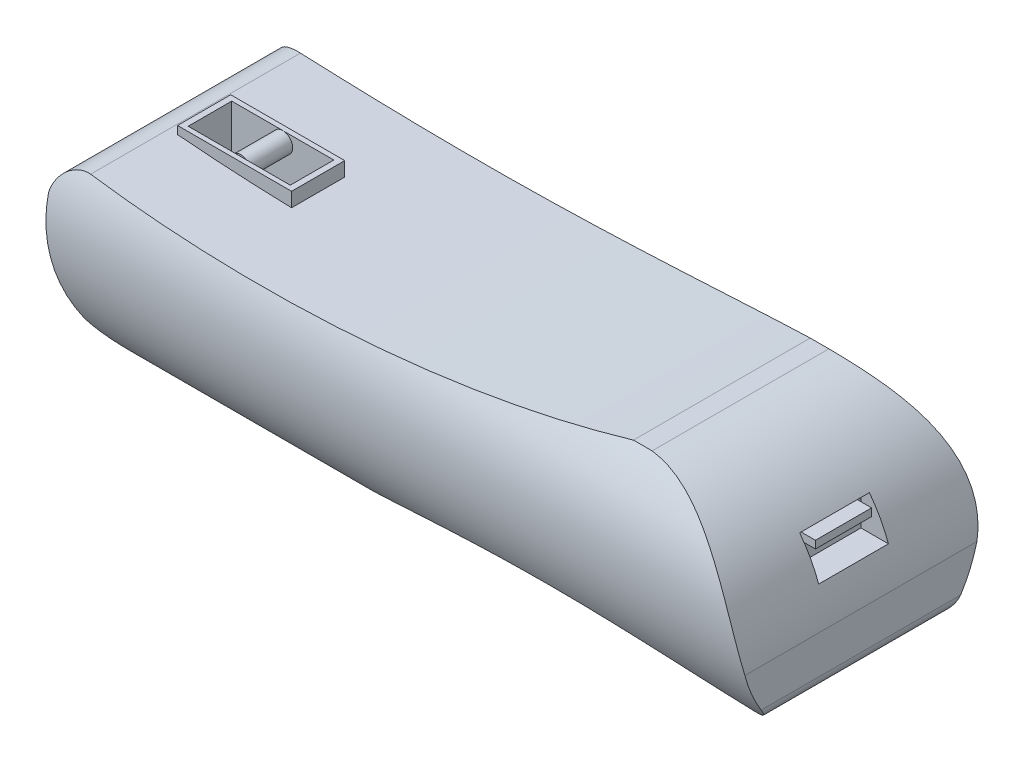
from build123d import *

# Parameters (mm, degrees)
SKETCH1_W           = 200
SKETCH1_H           = 70
BOSS_EXTRUDE1_DEPTH = 50
CUT_EXTRUDE5_DEPTH  = 200
CUT_EXTRUDE6_DEPTH  = 5
CUT_EXTRUDE7_DEPTH  = 40
CUT_EXTRUDE8_DEPTH  = 40
CUT_EXTRUDE9_DEPTH  = 40
SKETCH18_W          = 20
SKETCH18_H          = 10
CUT_EXTRUDE10_DEPTH = 20
SKETCH20_W          = 16.096890916
SKETCH20_H          = 2.175255529
BOSS_EXTRUDE2_DEPTH = 5
SKETCH22_W          = 29.287239855
SKETCH22_H          = 12.500651158
CUT_EXTRUDE11_DEPTH = 20
SKETCH23_W          = 32.71404676
SKETCH23_H          = 15.255254966
SKETCH23_W_2        = 29.287239855
SKETCH23_H_2        = 12.500651158
BOSS_EXTRUDE3_DEPTH = 20
SKETCH25_R          = 2.849998823
BOSS_EXTRUDE4_DEPTH = 12
CUT_EXTRUDE12_DEPTH = 12.2
SKETCH28_W          = 4
SKETCH28_H          = 4
CUT_EXTRUDE13_DEPTH = 20


with BuildPart() as part:
    # Sketch1 → Boss-Extrude1 (new body)
    with BuildSketch(Plane(origin=(0, 0, 0), x_dir=(1, 0, 0), z_dir=(0, 1, 0))):
        Rectangle(SKETCH1_W, SKETCH1_H)
    extrude(amount=BOSS_EXTRUDE1_DEPTH)

    # Sketch13 → Cut-Extrude5 (cut)
    with BuildSketch(Plane.ZY.offset(100)):
        with BuildLine():
            Line((-25.356792072, 50), (-35, 50))
            Line((-35, 50), (-35, 0))
            Line((-35, 0), (-25.356792072, 0))
            ThreePointArc((-25.356792072, 0), (-34.489414432, 25), (-25.356792072, 50))
        make_face()
    cut_extrude5 = extrude(amount=-CUT_EXTRUDE5_DEPTH, mode=Mode.SUBTRACT)

    # Mirror1: Cut-Extrude5 across plane
    add(cut_extrude5.mirror(Plane.XY), mode=Mode.SUBTRACT)

    # Sketch14 → Cut-Extrude6 (cut)
    with BuildSketch(Plane.XZ):
        with BuildLine():
            Line((-50.321008897, 22.5), (-50.321008897, -22.5))
            ThreePointArc((-50.321008897, -22.5), (-27.821008897, 0), (-50.321008897, 22.5))
        make_face()
    extrude(amount=-CUT_EXTRUDE6_DEPTH, mode=Mode.SUBTRACT)

    # Sketch15 → Cut-Extrude7 (cut, symmetric)
    with BuildSketch(Plane.XY):
        with BuildLine():
            Line((-14.177189609, 0), (94.750693697, 0))
            ThreePointArc((94.750693697, 0), (40.286752044, 6.203751873), (-14.177189609, 0))
        make_face()
    extrude(amount=CUT_EXTRUDE7_DEPTH, both=True, mode=Mode.SUBTRACT)

    # Sketch16 → Cut-Extrude8 (cut, symmetric)
    with BuildSketch(Plane.XY):
        with BuildLine():
            ThreePointArc((60.094183349, 50), (-19.72974209, 41.127256564), (-100, 43.823614043))
            Line((-100, 43.823614043), (-100, 50))
            Line((-100, 50), (60.094183349, 50))
        make_face()
        with BuildLine():
            Line((100, 0), (100, 4.500444902))
            ThreePointArc((100, 4.500444902), (98.543565753, 1.456434247), (95.499555098, 0))
            Line((95.499555098, 0), (100, 0))
        make_face()
        with BuildLine():
            ThreePointArc((100, 15.440425267), (89.162561497, 39.162561497), (65.440425267, 50))
            Line((65.440425267, 50), (100, 50))
            Line((100, 50), (100, 15.440425267))
        make_face()
    extrude(amount=CUT_EXTRUDE8_DEPTH, both=True, mode=Mode.SUBTRACT)

    # Sketch17 → Cut-Extrude9 (cut, symmetric)
    with BuildSketch(Plane.XY):
        with BuildLine():
            Line((-90.43469404, 42.891964914), (-105.221514707, 46.920266675))
            Line((-105.221514707, 46.920266675), (-103.893419297, 0))
            Line((-103.893419297, 0), (-84.831583922, 0))
            ThreePointArc((-84.831583922, 0), (-89.878284237, 1.691044202), (-93.746012604, 5.347475777))
            ThreePointArc((-93.746012604, 5.347475777), (-98.150815665, 20.070729134), (-100, 35.327104743))
            ThreePointArc((-100, 35.327104743), (-96.78408086, 41.090574557), (-90.43469404, 42.891964914))
        make_face()
    extrude(amount=CUT_EXTRUDE9_DEPTH, both=True, mode=Mode.SUBTRACT)

    # Sketch18 → Cut-Extrude10 (cut)
    with BuildSketch(Plane(origin=(110, 0, 0), x_dir=(0, 0, -1), z_dir=(1, 0, 0))):
        with Locations((0, 30.440425267)):
            Rectangle(SKETCH18_W, SKETCH18_H)
    extrude(amount=-CUT_EXTRUDE10_DEPTH, mode=Mode.SUBTRACT)

    # Sketch20 → Boss-Extrude2 (add)
    with BuildSketch(Plane(origin=(90, 0, 0), x_dir=(0, 0, -1), z_dir=(1, 0, 0))):
        with Locations((0, 32.828238053)):
            Rectangle(SKETCH20_W, SKETCH20_H)
    extrude(amount=BOSS_EXTRUDE2_DEPTH)

    # Sketch22 → Cut-Extrude11 (cut)
    with BuildSketch(Plane(origin=(0, 25, 0), x_dir=(1, 0, 0), z_dir=(0, 1, 0))):
        with Locations((-72.127800153, 0)):
            Rectangle(SKETCH22_W, SKETCH22_H)
    extrude(amount=CUT_EXTRUDE11_DEPTH, mode=Mode.SUBTRACT)

    # Sketch23 → Boss-Extrude3 (add)
    with BuildSketch(Plane(origin=(0, 25, 0), x_dir=(1, 0, 0), z_dir=(0, 1, 0))):
        with Locations((-72.128701672, 0.043393869)):
            Rectangle(SKETCH23_W, SKETCH23_H)
        with Locations((-72.127800153, 0)):
            Rectangle(SKETCH23_W_2, SKETCH23_H_2, mode=Mode.SUBTRACT)
    extrude(amount=BOSS_EXTRUDE3_DEPTH)

    # Sketch25 → Boss-Extrude4 (add)
    with BuildSketch(Plane.XY.offset(-6.250325579)):
        with Locations(Location((-72.128701672, 42.150001177, 0), (0, 0, 90))):
            Circle(SKETCH25_R)
    extrude(amount=BOSS_EXTRUDE4_DEPTH)

    # Sketch27 → Cut-Extrude12 (cut)
    with BuildSketch(Plane(origin=(-105, 0, 0), x_dir=(0, 0, -1), z_dir=(1, 0, 0))):
        with BuildLine():
            Line((-11.180339887, 29.915784745), (11.180339887, 29.915784745))
            ThreePointArc((11.180339887, 29.915784745), (15, 19.915784745), (11.180339887, 9.915784745))
            Line((11.180339887, 9.915784745), (-11.180339887, 9.915784745))
            ThreePointArc((-11.180339887, 9.915784745), (-15, 19.915784745), (-11.180339887, 29.915784745))
        make_face()
    extrude(amount=CUT_EXTRUDE12_DEPTH, mode=Mode.SUBTRACT)

    # Sketch28 → Cut-Extrude13 (cut)
    with BuildSketch(Plane.ZY.offset(92.8)):
        with Locations((-9.180339887, 19.915784745)):
            Rectangle(SKETCH28_W, SKETCH28_H)
        with Locations((9.180339887, 19.915784745)):
            Rectangle(SKETCH28_W, SKETCH28_H)
    extrude(amount=-CUT_EXTRUDE13_DEPTH, mode=Mode.SUBTRACT)


solid = part.part
